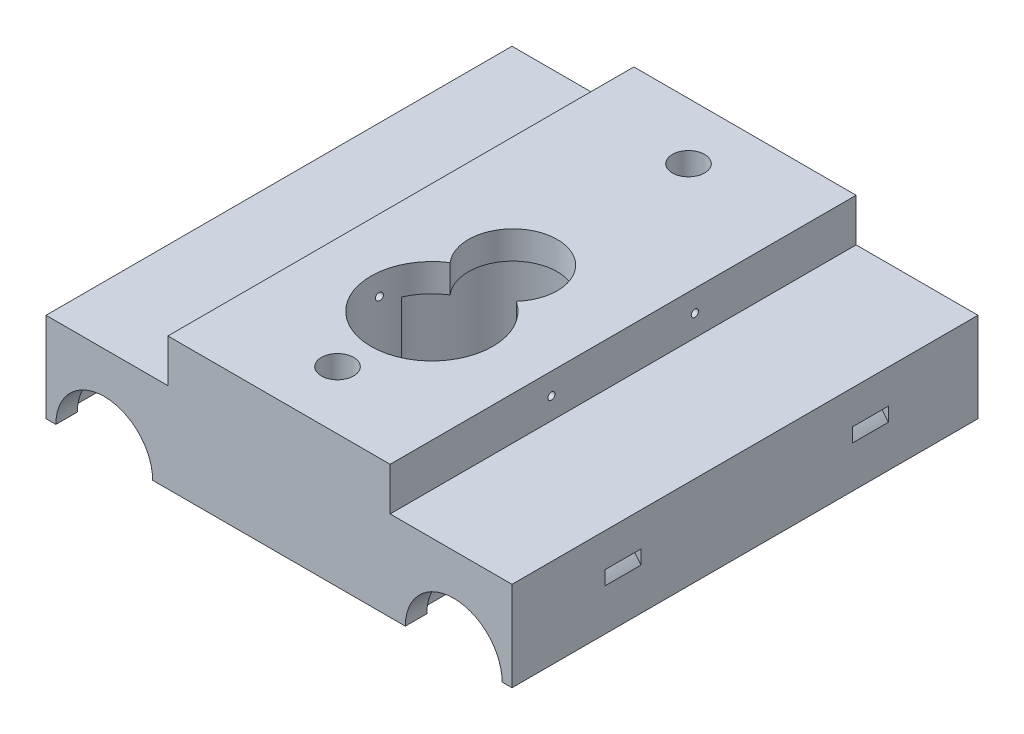
from build123d import *
from build123d.topology import SkipClean

# Parameters (mm, degrees)
SKETCH_1_W           = 65
SKETCH_1_H           = 65
EXTRUDE_1_DEPTH      = 17
CUT_EXTRUDE_1_DEPTH  = 59
CUT_EXTRUDE_2_DEPTH  = 79.260612028
EXTRUDE_2_DEPTH      = 10
SKETCH_12_W          = 35.24
SKETCH_12_H          = 8.5
CUT_EXTRUDE_5_DEPTH  = 79.260612028
SKETCH_17_R          = 2.25
CUT_EXTRUDE_8_DEPTH  = 58.965697588
EXTRUDE_START        = 10
SKETCH_18_W          = 65
SKETCH_18_H          = 65
SKETCH_18_R          = 2.25
EXTRUDE_3_DEPTH      = 10
CUT_EXTRUDE_START    = -10
SKETCH_9_R           = 11.25
SKETCH_9_R_2         = 10
CUT_EXTRUDE_3_DEPTH  = 5
CUT_EXTRUDE_START_2  = -20
SKETCH_10_R          = 11.25
SKETCH_10_R_2        = 10
CUT_EXTRUDE_4_DEPTH  = 5
SKETCH_19_W          = 65
SKETCH_19_H          = 6
CUT_EXTRUDE_9_DEPTH  = 17
SKETCH_20_W          = 65
SKETCH_20_H          = 6
CUT_EXTRUDE_10_DEPTH = 17
SKETCH_21_R          = 0.5
CUT_EXTRUDE_11_DEPTH = 69.629794564
CUT_EXTRUDE_12_DEPTH = 3.9
CUT_EXTRUDE_13_DEPTH = 60.168674963


with BuildPart() as part:
    # Эскиз1 → Бобышка-Вытянуть1 (new body)
    with BuildSketch(Plane(origin=(0, 0, 0), x_dir=(1, 0, 0), z_dir=(0, 1, 0))):
        with Locations((7.633818594, -8.451785088)):
            Rectangle(SKETCH_1_W, SKETCH_1_H)
    extrude(amount=EXTRUDE_1_DEPTH)

    # Эскиз3 → Вырез-Вытянуть1 (cut)
    with BuildSketch(Plane.XY.offset(37.951785088)):
        with BuildLine():
            Line((39.753818594, 8.5), (40.133818594, 8.5))
            Line((40.133818594, 8.5), (40.133818594, 0))
            Line((40.133818594, 0), (24.253818594, 0))
            Line((24.253818594, 0), (24.253818594, 8.5))
            ThreePointArc((24.253818594, 8.5), (32.003818594, 16.25), (39.753818594, 8.5))
        make_face()
        with BuildLine():
            Line((-24.486181406, 8.5), (-24.866181406, 8.5))
            Line((-24.866181406, 8.5), (-24.866181406, 0))
            Line((-24.866181406, 0), (-8.986181406, 0))
            Line((-8.986181406, 0), (-8.986181406, 8.5))
            ThreePointArc((-8.986181406, 8.5), (-16.736181406, 16.25), (-24.486181406, 8.5))
        make_face()
    extrude(amount=-CUT_EXTRUDE_1_DEPTH, mode=Mode.SUBTRACT)

    # Эскиз5 → Вырез-Вытянуть2 (cut, through all)
    with BuildSketch(Plane.XY.offset(40.951785088)):
        with BuildLine():
            Line((-23.486181406, 8.5), (-24.866181406, 8.5))
            Line((-24.866181406, 8.5), (-24.866181406, 0))
            Line((-24.866181406, 0), (-9.986181406, 0))
            Line((-9.986181406, 0), (-9.986181406, 8.5))
            ThreePointArc((-9.986181406, 8.5), (-16.736181406, 15.25), (-23.486181406, 8.5))
        make_face()
        with BuildLine():
            Line((38.753818594, 8.5), (40.133818594, 8.5))
            Line((40.133818594, 8.5), (40.133818594, 0))
            Line((40.133818594, 0), (25.253818594, 0))
            Line((25.253818594, 0), (25.253818594, 8.5))
            ThreePointArc((25.253818594, 8.5), (32.003818594, 15.25), (38.753818594, 8.5))
        make_face()
    extrude(amount=-CUT_EXTRUDE_2_DEPTH, mode=Mode.SUBTRACT)

    # Эскиз6 → Бобышка-Вытянуть2 (add)
    with BuildSketch(Plane.XY.offset(13.451785088)):
        with BuildLine():
            Line((-23.486181406, 8.5), (-24.866181406, 8.5))
            Line((-24.866181406, 8.5), (-24.866181406, 17))
            Line((-24.866181406, 17), (-9.986181406, 17))
            Line((-9.986181406, 17), (40.133818594, 17))
            Line((40.133818594, 17), (40.133818594, 8.5))
            Line((40.133818594, 8.5), (38.753818594, 8.5))
            ThreePointArc((38.753818594, 8.5), (32.003818594, 15.25), (25.253818594, 8.5))
            Line((25.253818594, 8.5), (25.253818594, 0))
            Line((25.253818594, 0), (-9.986181406, 0))
            Line((-9.986181406, 0), (-9.986181406, 8.5))
            ThreePointArc((-9.986181406, 8.5), (-16.736181406, 15.25), (-23.486181406, 8.5))
        make_face()
    extrude(amount=-EXTRUDE_2_DEPTH)

    # Эскиз12 → Вырез-Вытянуть5 (cut, through all)
    with BuildSketch(Plane.XY.offset(40.951785088)):
        with Locations((7.633818594, 4.25)):
            Rectangle(SKETCH_12_W, SKETCH_12_H)
    extrude(amount=-CUT_EXTRUDE_5_DEPTH, mode=Mode.SUBTRACT)

    # Эскиз17 → Вырез-Вытянуть8 (cut, through all)
    with BuildSketch(Plane(origin=(0, 17, 0), x_dir=(1, 0, 0), z_dir=(0, 1, 0))):
        with Locations(Location((7.633818594, 16.168732948, 0), (0, 0, 270))):
            Circle(SKETCH_17_R)
        with Locations(Location((7.676184998, -32.831267052, 0), (0, 0, 270))):
            Circle(SKETCH_17_R)
    extrude(amount=-CUT_EXTRUDE_8_DEPTH, mode=Mode.SUBTRACT)

    # Эскиз18 → Бобышка-Вытянуть3 (add)
    with BuildSketch(Plane(origin=(0, 17, 0), x_dir=(1, 0, 0), z_dir=(0, 1, 0)).offset(EXTRUDE_START)):
        with Locations((7.633818594, -8.451785088)):
            Rectangle(SKETCH_18_W, SKETCH_18_H)
        with Locations(Location((7.633818594, 16.168732948, 0), (0, 0, 270))):
            Circle(SKETCH_18_R, mode=Mode.SUBTRACT)
        with Locations(Location((7.676184998, -32.831267052, 0), (0, 0, 270))):
            Circle(SKETCH_18_R, mode=Mode.SUBTRACT)
    extrude(amount=-EXTRUDE_3_DEPTH)

    # Эскиз9 → Вырез-Вытянуть3 (cut)
    # profile 1 of 2: a face of its own
    with BuildSketch(Plane.XY.offset(37.951785088).offset(CUT_EXTRUDE_START)):
        with Locations((-16.736181406, 8.5)):
            Circle(SKETCH_9_R)
        with Locations((-16.736181406, 8.5)):
            Circle(SKETCH_9_R_2, mode=Mode.SUBTRACT)
    # profile 2 of 2: a face of its own
    with BuildSketch(Plane.XY.offset(37.951785088).offset(CUT_EXTRUDE_START)):
        with Locations((32.003818594, 8.5)):
            Circle(SKETCH_9_R)
        with Locations((32.003818594, 8.5)):
            Circle(SKETCH_9_R_2, mode=Mode.SUBTRACT)
    extrude(amount=-CUT_EXTRUDE_3_DEPTH, mode=Mode.SUBTRACT)

    # Эскиз10 → Вырез-Вытянуть4 (cut)
    # profile 1 of 2: a face of its own
    with BuildSketch(Plane.XY.offset(13.451785088).offset(CUT_EXTRUDE_START_2)):
        with Locations((-16.736181406, 8.5)):
            Circle(SKETCH_10_R)
        with Locations((-16.736181406, 8.5)):
            Circle(SKETCH_10_R_2, mode=Mode.SUBTRACT)
    # profile 2 of 2: a face of its own
    with BuildSketch(Plane.XY.offset(13.451785088).offset(CUT_EXTRUDE_START_2)):
        with Locations((32.003818594, 8.5)):
            Circle(SKETCH_10_R)
        with Locations((32.003818594, 8.5)):
            Circle(SKETCH_10_R_2, mode=Mode.SUBTRACT)
    extrude(amount=-CUT_EXTRUDE_4_DEPTH, mode=Mode.SUBTRACT)

    # Эскиз19 → Вырез-Вытянуть9 (cut)
    with BuildSketch(Plane(origin=(40.133818594, 0, 0), x_dir=(0, 0, -1), z_dir=(1, 0, 0))):
        with Locations((-8.451785088, 24)):
            Rectangle(SKETCH_19_W, SKETCH_19_H)
    extrude(amount=-CUT_EXTRUDE_9_DEPTH, mode=Mode.SUBTRACT)

    # Эскиз20 → Вырез-Вытянуть10 (cut)
    with BuildSketch(Plane.ZY.offset(24.866181406)):
        with Locations((8.451785088, 24)):
            Rectangle(SKETCH_20_W, SKETCH_20_H)
    extrude(amount=-CUT_EXTRUDE_10_DEPTH, mode=Mode.SUBTRACT)

    # Эскиз21 → Вырез-Вытянуть11 (cut, through all)
    with BuildSketch(Plane(origin=(23.133818594, 0, 0), x_dir=(0, 0, -1), z_dir=(1, 0, 0))):
        with Locations((-18.451785088, 24)):
            Circle(SKETCH_21_R)
        with Locations((1.548214912, 24)):
            Circle(SKETCH_21_R)
    extrude(amount=-CUT_EXTRUDE_11_DEPTH, mode=Mode.SUBTRACT)

    # Эскиз13 → Вырез-Вытянуть12 (cut)
    with BuildSketch(Plane.XZ.offset(-27)):
        with BuildLine():
            ThreePointArc((2.962122683, 12.40744876), (7.675512515, 2.131407246), (12.250269981, 12.469911346))
            ThreePointArc((12.250269981, 12.469911346), (7.501160594, 28.057428262), (2.962122683, 12.40744876))
        make_face()
    extrude(amount=CUT_EXTRUDE_12_DEPTH, mode=Mode.SUBTRACT)

    # Эскиз24 → Вырез-Вытянуть13 (cut, through all)
    with SkipClean():  # the faces are left unmerged after this step: merging them gives an invalid solid
        with BuildSketch(Plane(origin=(0, 23.1, 0), x_dir=(1, 0, 0), z_dir=(0, 1, 0))):
            with BuildLine():
                ThreePointArc((-0.190214084, -16.063311585), (7.501160594, -28.057428262), (15.353152659, -16.167840384))
                ThreePointArc((15.353152659, -16.167840384), (7.707791679, 2.668484217), (-0.190214084, -16.063311585))
            make_face()
        extrude(amount=-CUT_EXTRUDE_13_DEPTH, mode=Mode.SUBTRACT)


solid = part.part
